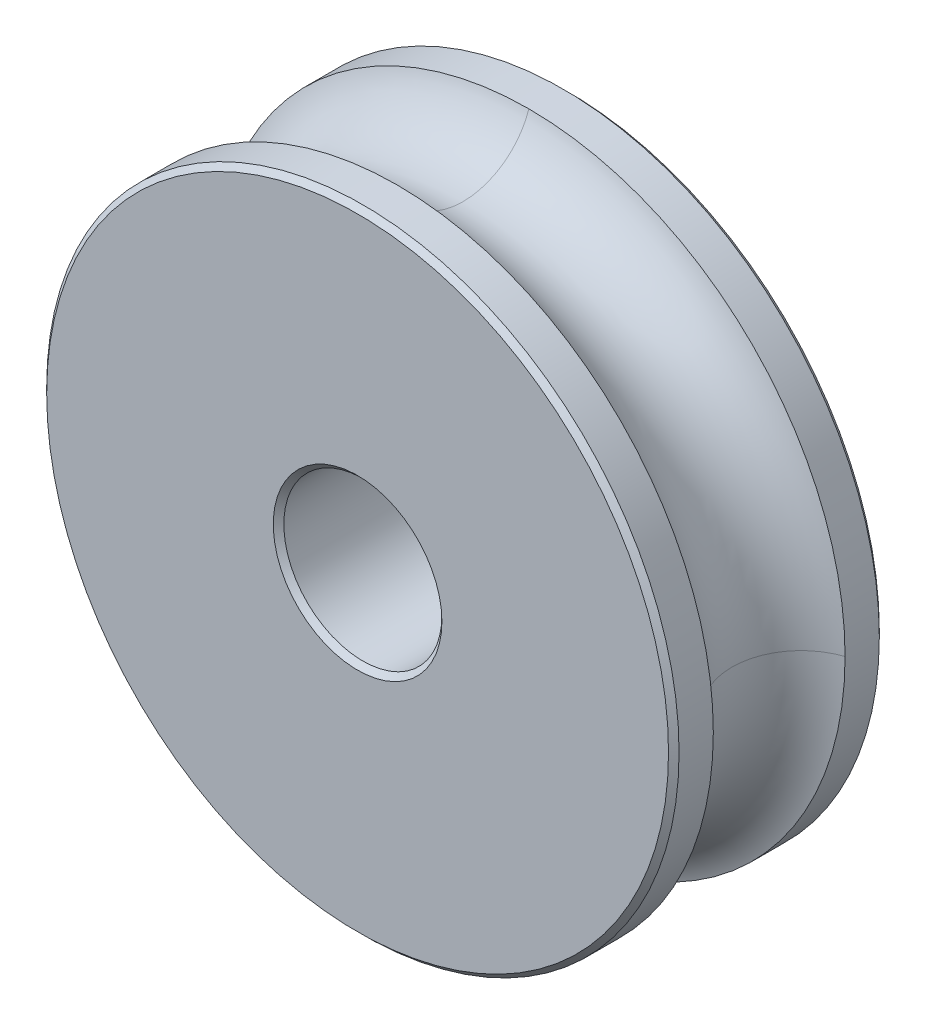
from build123d import *

# Parameters (mm, degrees)
SKETCH_1_R      = 6
SKETCH_1_R_2    = 1.5
EXTRUDE_1_DEPTH = 2
CHAMFER_1_SIZE  = 0.1


with BuildPart() as part:
    # 草图1 → 凸台-拉伸1 (new, symmetric)
    with BuildSketch(Plane.XY):
        Circle(SKETCH_1_R)
        Circle(SKETCH_1_R_2, mode=Mode.SUBTRACT)
    extrude(amount=EXTRUDE_1_DEPTH, both=True)

    # 切除-扫描1: sweep along a curve in space
    with BuildLine() as sweep_1_path:
        ThreePointArc((6, 0, -2), (4.242640687, 4.242640687, -2), (0, 6, -2))
        ThreePointArc((0, 6, -2), (-4.242640687, 4.242640687, -2), (-6, 0, -2))
        ThreePointArc((-6, 0, -2), (-4.242640687, -4.242640687, -2), (0, -6, -2))
        ThreePointArc((0, -6, -2), (4.242640687, -4.242640687, -2), (6, 0, -2))
    # 草图2 → 切除-扫描1 (sweep, cut)
    with BuildSketch(Plane(origin=(0, 0, 0), x_dir=(0, 0, -1), z_dir=(1, 0, 0))):
        with BuildLine():
            Line((-1.25, 6), (1.25, 6))
            ThreePointArc((1.25, 6), (0, 5.1), (-1.25, 6))
        make_face()
    sweep(path=sweep_1_path.line, mode=Mode.SUBTRACT)

    # 倒角1
    chamfer_1_edges = [part.edges().sort_by_distance(p)[0] for p in [
        (-6, 0, -2),
        (-6, 0, 2),
        (-1.5, 0, -2),
        (-1.5, 0, 2),
    ]]
    chamfer(chamfer_1_edges, length=CHAMFER_1_SIZE)


solid = part.part
